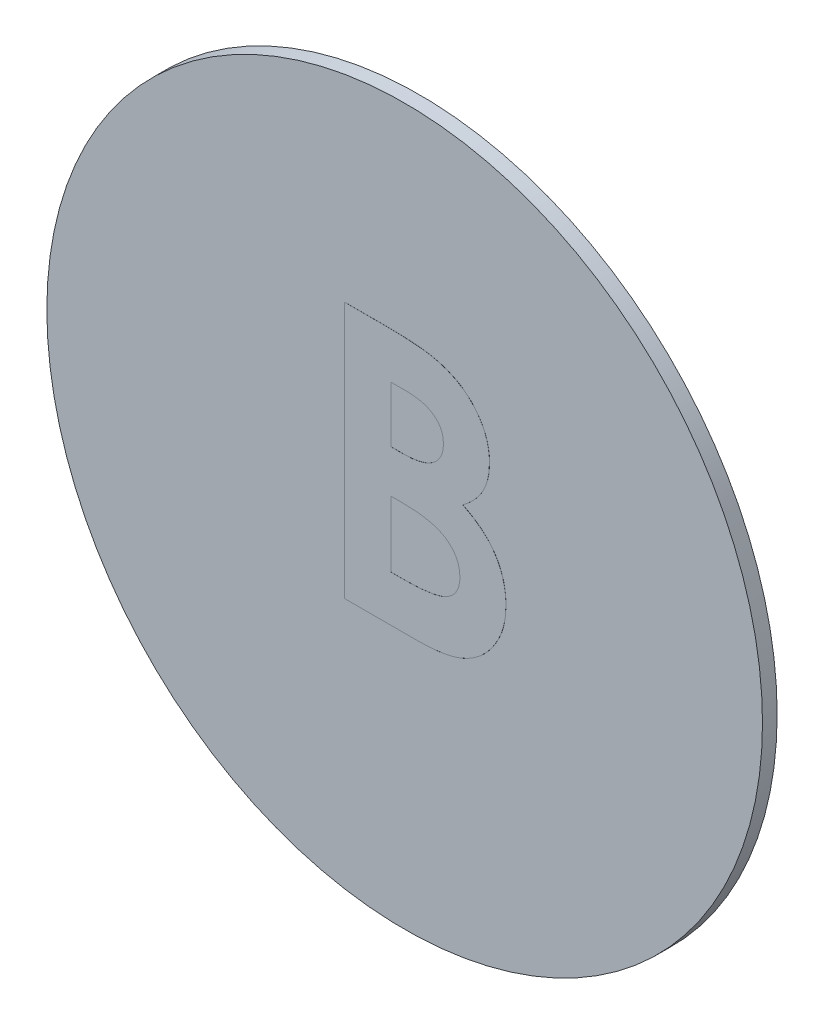
from build123d import *

# Parameters (mm, degrees)
SKETCH1_R           = 4.88
BOSS_EXTRUDE1_DEPTH = 0.2
BOSS_EXTRUDE2_DEPTH = 0.001


with BuildPart() as part:
    # Sketch1 → Boss-Extrude1 (new body)
    with BuildSketch(Plane.XY):
        with Locations((-24.02000111, -6.774872108)):
            Circle(SKETCH1_R)
    extrude(amount=BOSS_EXTRUDE1_DEPTH)

    # Sketch3 → Boss-Extrude2 (add)
    with BuildSketch(Plane.XY.offset(0.2)):
        with BuildLine():
            Line((-24.836675582, -8.155782129), (-24.836675582, -4.655782129))
            Line((-24.836675582, -4.655782129), (-24.275778146, -4.655782129))
            add(Edge.make_bspline(
                [(-24.275778146, -4.655782129), (-24.236511819, -4.655777648), (-24.160532219, -4.655768977), (-24.050913486, -4.659618427), (-23.949251368, -4.664598122), (-23.855869395, -4.670169242), (-23.770608623, -4.679769396), (-23.693598705, -4.68988691), (-23.624685775, -4.702088007), (-23.582080655, -4.71303277), (-23.562036159, -4.718181969)],
                knots=[0, 0, 0, 0, 1.311965854, 2.538629056, 3.664479157, 4.713267157, 5.663616078, 6.530575999, 7.308677837, 8, 8, 8, 8], degree=3))
            add(Edge.make_bspline(
                [(-23.562036159, -4.718181969), (-23.535715701, -4.725445006), (-23.484066512, -4.739697417), (-23.410088391, -4.768480776), (-23.339909823, -4.800475521), (-23.273616496, -4.836975541), (-23.211615476, -4.878421493), (-23.154142389, -4.925142306), (-23.099957682, -4.975262607), (-23.05098533, -5.030179235), (-23.006722392, -5.088208826), (-22.968265836, -5.149336173), (-22.934852017, -5.2126266), (-22.90811221, -5.278876575), (-22.887964268, -5.347780999), (-22.873228147, -5.419045639), (-22.863677145, -5.492895994), (-22.8627747, -5.543138805), (-22.862316608, -5.568642706)],
                knots=[0, 0, 0, 0, 1.099996261, 2.158545794, 3.195537121, 4.207578794, 5.205712374, 6.197378256, 7.190519799, 8.17788031, 9.159561366, 10.129234751, 11.085776129, 12.040971148, 13.00380137, 13.975669004, 14.972423361, 16, 16, 16, 16], degree=3))
            add(Edge.make_bspline(
                [(-22.862316608, -5.568642706), (-22.863514384, -5.601408525), (-22.865872058, -5.665904014), (-22.880933042, -5.760636218), (-22.909174734, -5.850171768), (-22.946128301, -5.936160769), (-22.996373599, -6.018282481), (-23.06017541, -6.096497859), (-23.136500353, -6.17321527), (-23.195045798, -6.219202183), (-23.225497698, -6.243121873)],
                knots=[0, 0, 0, 0, 0.986156485, 1.941127874, 2.875419072, 3.804401753, 4.751181392, 5.761612777, 6.835722519, 8, 8, 8, 8], degree=3))
            add(Edge.make_bspline(
                [(-23.225497698, -6.243121873), (-23.200820939, -6.255719144), (-23.152436643, -6.280418908), (-23.083745156, -6.321017946), (-23.020144338, -6.364200172), (-22.961349022, -6.409096743), (-22.908592505, -6.457610888), (-22.859696385, -6.506947156), (-22.81707294, -6.559932311), (-22.778957771, -6.61467786), (-22.745828686, -6.671976526), (-22.716976906, -6.731731543), (-22.692606843, -6.794147048), (-22.671969642, -6.858905396), (-22.656578413, -6.926229327), (-22.646543004, -6.996142917), (-22.638859268, -7.068407727), (-22.638261545, -7.11763271), (-22.637957634, -7.142661136)],
                knots=[0, 0, 0, 0, 1.164658916, 2.283573913, 3.35186032, 4.395461096, 5.390182219, 6.362969632, 7.312859996, 8.245001507, 9.165155236, 10.092416118, 11.032087915, 11.979892451, 12.947605196, 13.931445124, 14.948243989, 16, 16, 16, 16], degree=3))
            add(Edge.make_bspline(
                [(-22.637957634, -7.142661136), (-22.639929818, -7.190463998), (-22.643821916, -7.284802755), (-22.672279037, -7.423313716), (-22.721614642, -7.554634671), (-22.787862186, -7.678243692), (-22.869491907, -7.790562503), (-22.963342678, -7.888952806), (-23.068469636, -7.972238013), (-23.16546196, -8.028449067), (-23.249352683, -8.06617194), (-23.318837801, -8.0894946), (-23.393463346, -8.111100676), (-23.474596277, -8.126272909), (-23.560765765, -8.140160205), (-23.652811968, -8.148734509), (-23.750562854, -8.154545104), (-23.817702388, -8.155361451), (-23.852300582, -8.155782129)],
                knots=[0, 0, 0, 0, 1.284142165, 2.534249414, 3.780121997, 5.041676246, 6.291546858, 7.49970053, 8.684500223, 9.883330709, 10.50184324, 11.153274765, 11.851151195, 12.587658647, 13.369265475, 14.195992086, 15.070362669, 16, 16, 16, 16], degree=3))
            Line((-23.852300582, -8.155782129), (-24.836675582, -8.155782129))
        make_face()
        with BuildLine():
            Line((-24.208470454, -5.283987258), (-24.208470454, -6.04680777))
            Line((-24.208470454, -6.04680777), (-24.041603467, -6.04680777))
            add(Edge.make_bspline(
                [(-24.041603467, -6.04680777), (-24.018924744, -6.046610003), (-23.975144842, -6.046228226), (-23.911909418, -6.041311067), (-23.853110685, -6.032922088), (-23.798971656, -6.021217352), (-23.748988004, -6.006354044), (-23.70347904, -5.988470283), (-23.662644859, -5.966650151), (-23.615204985, -5.934148102), (-23.565057617, -5.886319881), (-23.520913454, -5.817222107), (-23.494912836, -5.737759929), (-23.492017068, -5.681717049), (-23.490521736, -5.652777322)],
                knots=[0, 0, 0, 0, 1.065314748, 2.056525647, 2.977365736, 3.853934255, 4.656397591, 5.425096493, 6.14721249, 6.826394842, 8.123232004, 9.372140726, 10.643011755, 12, 12, 12, 12], degree=3))
            add(Edge.make_bspline(
                [(-23.490521736, -5.652777322), (-23.491718276, -5.625670459), (-23.494031737, -5.573260429), (-23.520211016, -5.49967208), (-23.560872612, -5.434457742), (-23.608879341, -5.389823861), (-23.654087005, -5.359340236), (-23.692796581, -5.339268067), (-23.735283248, -5.321299666), (-23.782369501, -5.307560589), (-23.833786453, -5.29725127), (-23.889284342, -5.289680309), (-23.948958922, -5.284527191), (-23.990176282, -5.284171096), (-24.01145523, -5.283987258)],
                knots=[0, 0, 0, 0, 1.347982417, 2.606269829, 3.849316587, 5.153353503, 5.842674298, 6.568177932, 7.326619318, 8.142485038, 9.012069166, 9.942760135, 10.937925643, 12, 12, 12, 12], degree=3))
            Line((-24.01145523, -5.283987258), (-24.208470454, -5.283987258))
        make_face(mode=Mode.SUBTRACT)
        with BuildLine():
            Line((-24.208470454, -6.630141104), (-24.208470454, -7.527577001))
            Line((-24.208470454, -7.527577001), (-24.027581031, -7.527577001))
            add(Edge.make_bspline(
                [(-24.027581031, -7.527577001), (-23.991818962, -7.527372694), (-23.923061921, -7.526979887), (-23.824567582, -7.522233852), (-23.735011604, -7.513679959), (-23.654631277, -7.503001112), (-23.583303484, -7.488532946), (-23.521269328, -7.470138526), (-23.467678092, -7.449901461), (-23.422851113, -7.424906282), (-23.386230038, -7.395818093), (-23.353183358, -7.366089264), (-23.326239154, -7.331794252), (-23.304920397, -7.294405246), (-23.286469051, -7.254851016), (-23.275340502, -7.211586983), (-23.266867615, -7.165895389), (-23.266401329, -7.134291502), (-23.266162762, -7.118121873)],
                knots=[0, 0, 0, 0, 1.753078804, 3.370512758, 4.83203934, 6.162291463, 7.344201807, 8.395507345, 9.331626367, 10.147333109, 10.898971645, 11.62040215, 12.321813352, 13.025280112, 13.727906689, 14.453419512, 15.208716525, 16, 16, 16, 16], degree=3))
            add(Edge.make_bspline(
                [(-23.266162762, -7.118121873), (-23.266688872, -7.099631647), (-23.267713593, -7.063617662), (-23.276082503, -7.010979379), (-23.291291546, -6.961838049), (-23.310448079, -6.914937062), (-23.337105411, -6.871955637), (-23.368786739, -6.83140635), (-23.407065872, -6.794662324), (-23.450112989, -6.759501145), (-23.50032319, -6.728715627), (-23.557720031, -6.702003737), (-23.622615324, -6.679694951), (-23.695210087, -6.66193268), (-23.775186072, -6.646858087), (-23.863127016, -6.63785689), (-23.958300515, -6.631162305), (-24.024295368, -6.630489239), (-24.05843039, -6.630141104)],
                knots=[0, 0, 0, 0, 0.845221588, 1.646264278, 2.427170338, 3.19324141, 3.95557735, 4.731569926, 5.540061037, 6.376114724, 7.268642756, 8.224665384, 9.265483498, 10.400594375, 11.639216012, 12.983232105, 14.439614077, 16, 16, 16, 16], degree=3))
            Line((-24.05843039, -6.630141104), (-24.208470454, -6.630141104))
        make_face(mode=Mode.SUBTRACT)
    extrude(amount=BOSS_EXTRUDE2_DEPTH)


solid = part.part
